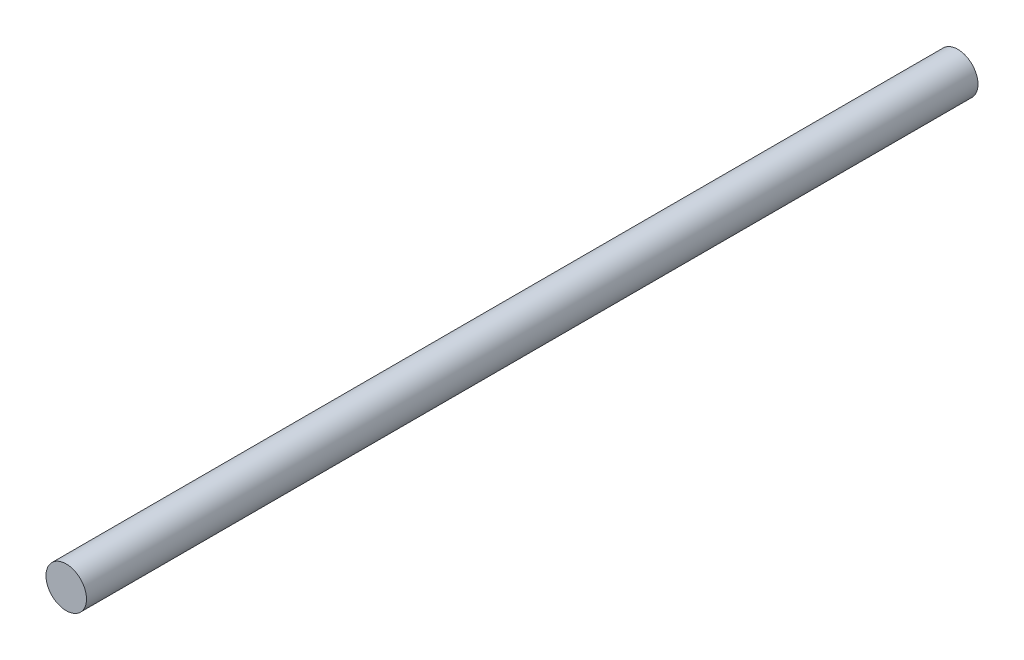
from build123d import *

# Parameters (mm, degrees)
SKETCH1_R           = 2.5
BOSS_EXTRUDE1_DEPTH = 110


with BuildPart() as part:
    # Sketch1 → Boss-Extrude1 (new body)
    with BuildSketch(Plane.XY):
        Circle(SKETCH1_R)
    extrude(amount=BOSS_EXTRUDE1_DEPTH)


solid = part.part
